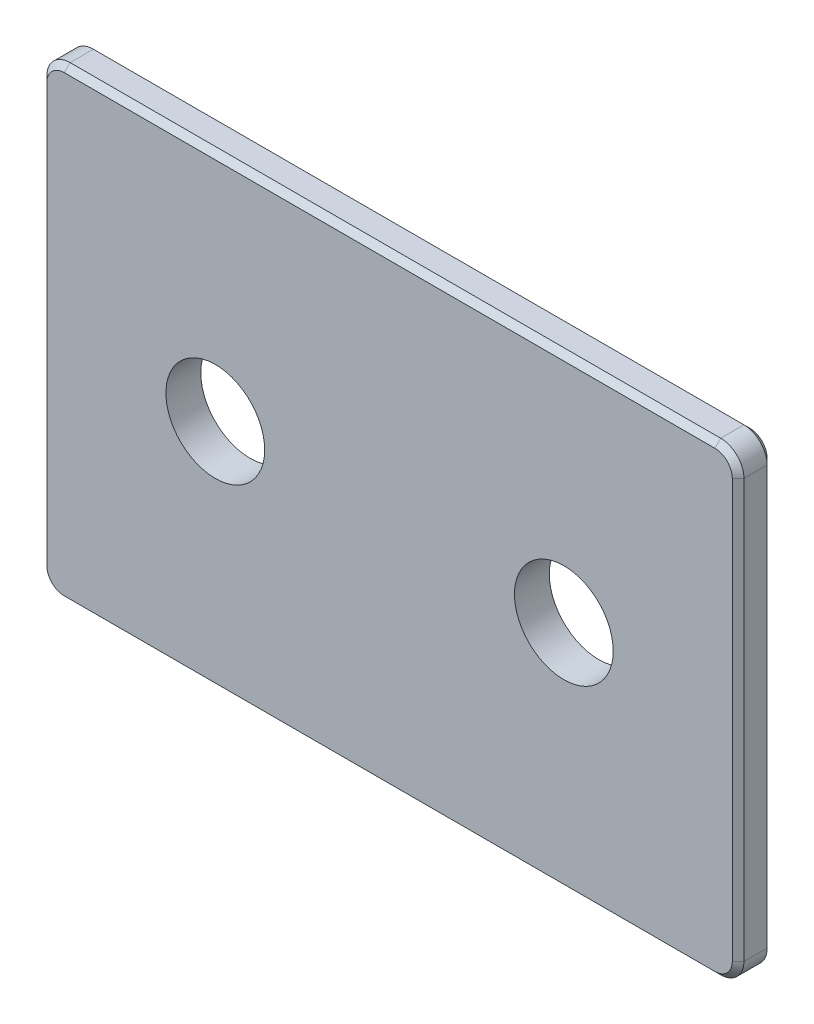
from build123d import *

# Parameters (mm, degrees)
SZKIC1_W                    = 60
SZKIC1_H                    = 40
DODANIE_WYCI_GNI_CIE1_DEPTH = 3
OTW_R_GWINTOWANY_M101_D     = 8.5
OTW_R_GWINTOWANY_M101_DEPTH = 27.5
OTW_R_GWINTOWANY_M101_TIP   = 2.553657631
ZAOKR_GLENIE1_R             = 2
SFAZOWANIE1_SIZE            = 0.5


with BuildPart() as part:
    # Szkic1 → Dodanie-wyciągnięcie1 (new body)
    with BuildSketch(Plane.XY):
        with Locations((30, 20)):
            Rectangle(SZKIC1_W, SZKIC1_H)
    extrude(amount=DODANIE_WYCI_GNI_CIE1_DEPTH)

    # Otwór gwintowany M101
    with Locations(Plane.XY.offset(3)):
        with Locations((15, 20), (45, 20)):
            Hole(OTW_R_GWINTOWANY_M101_D / 2, depth=OTW_R_GWINTOWANY_M101_DEPTH)
            with Locations((0, 0, -(OTW_R_GWINTOWANY_M101_DEPTH + OTW_R_GWINTOWANY_M101_TIP / 2))):  # 118° drill point
                Cone(0, OTW_R_GWINTOWANY_M101_D / 2, OTW_R_GWINTOWANY_M101_TIP, mode=Mode.SUBTRACT)

    # Zaokrąglenie1
    zaokr_glenie1_edges = [part.edges().sort_by_distance(p)[0] for p in [
        (0, 40, 1.5),
        (60, 40, 1.5),
        (60, 0, 1.5),
        (0, 0, 1.5),
    ]]
    fillet(zaokr_glenie1_edges, radius=ZAOKR_GLENIE1_R)

    # Sfazowanie1
    sfazowanie1_edges = [part.edges().sort_by_distance(p)[0] for p in [
        (60, 20, 0),
        (60, 20, 3),
        (0, 20, 0),
        (30, 40, 0),
        (30, 0, 0),
        (59.414213562, 39.414213562, 0),
        (0.585786438, 39.414213562, 0),
        (0.585786438, 0.585786438, 0),
        (59.414213562, 0.585786438, 0),
        (30, 0, 3),
        (0, 20, 3),
        (30, 40, 3),
        (59.414213562, 39.414213562, 3),
        (0.585786438, 39.414213562, 3),
        (0.585786438, 0.585786438, 3),
        (59.414213562, 0.585786438, 3),
    ]]
    chamfer(sfazowanie1_edges, length=SFAZOWANIE1_SIZE)


solid = part.part
